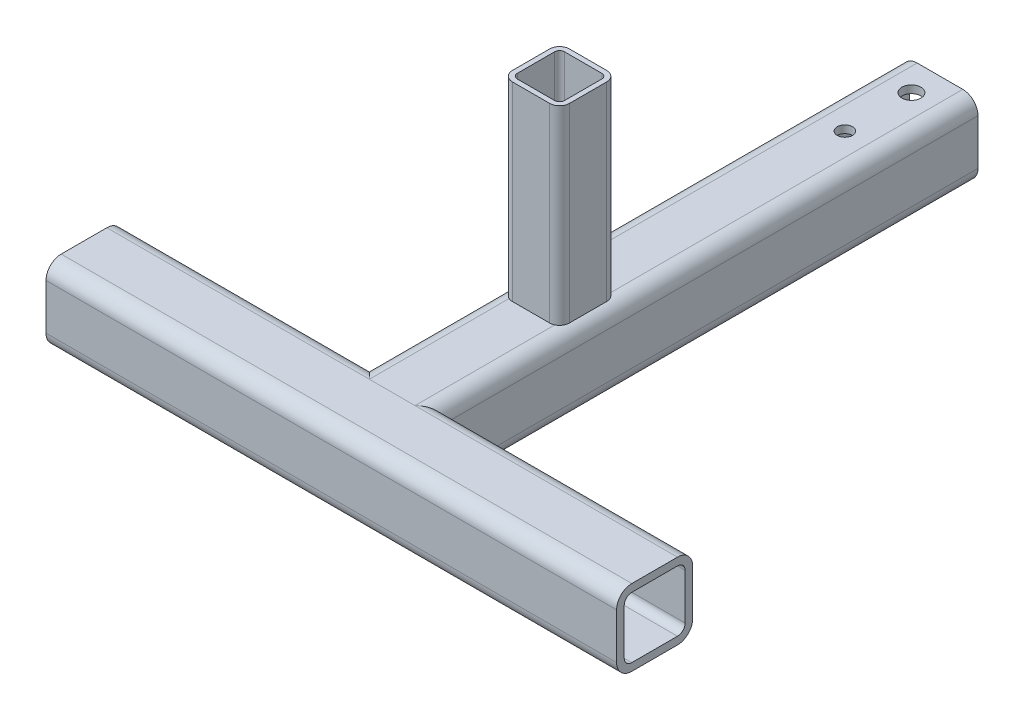
from build123d import *

# Parameters (mm, degrees)
SQUARE_TUBE_CONFIGURED_40_X_40_X_4_1_DEPTH   = 300
SQUARE_TUBE_CONFIGURED_40_X_40_X_4_2_DEPTH   = 300
SQUARE_TUBE_CONFIGURED_30_X_30_X_2_6_1_DEPTH = 100
CORTE_EXTRUS_O1_DEPTH                        = 351.000000086
CORTE_EXTRUS_O1_DEPTH_BACK                   = 351.000000086
ESBO_O8_R                                    = 5
ESBO_O8_R_2                                  = 4


with BuildPart() as part:
    # Sketch11 → Square tube - configured 40 X 40 X 4(1) (new body)
    with BuildSketch(Plane(origin=(-150, 0, 0), x_dir=(0, 0, -1), z_dir=(1, 0, 0))):
        with BuildLine():
            Line((-12, -20), (12, -20))
            ThreePointArc((12, -20), (17.656854249, -17.656854249), (20, -12))
            Line((20, -12), (20, 12))
            ThreePointArc((20, 12), (17.656854249, 17.656854249), (12, 20))
            Line((12, 20), (-12, 20))
            ThreePointArc((-12, 20), (-17.656854249, 17.656854249), (-20, 12))
            Line((-20, 12), (-20, -12))
            ThreePointArc((-20, -12), (-17.656854249, -17.656854249), (-12, -20))
        make_face()
        with BuildLine():
            Line((-12, -16), (12, -16))
            ThreePointArc((12, -16), (14.828427125, -14.828427125), (16, -12))
            Line((16, -12), (16, 12))
            ThreePointArc((16, 12), (14.828427125, 14.828427125), (12, 16))
            Line((12, 16), (-12, 16))
            ThreePointArc((-12, 16), (-14.828427125, 14.828427125), (-16, 12))
            Line((-16, 12), (-16, -12))
            ThreePointArc((-16, -12), (-14.828427125, -14.828427125), (-12, -16))
        make_face(mode=Mode.SUBTRACT)
    extrude(amount=SQUARE_TUBE_CONFIGURED_40_X_40_X_4_1_DEPTH)


with BuildPart() as body_2:
    # Sketch1 → Square tube - configured 40 X 40 X 4(2) (new body)
    with BuildSketch(Plane(origin=(0, 0, 0), x_dir=(-1, 0, 0), z_dir=(0, 0, -1))):
        with BuildLine():
            Line((-12, -20), (12, -20))
            ThreePointArc((12, -20), (17.656854249, -17.656854249), (20, -12))
            Line((20, -12), (20, 12))
            ThreePointArc((20, 12), (17.656854249, 17.656854249), (12, 20))
            Line((12, 20), (-12, 20))
            ThreePointArc((-12, 20), (-17.656854249, 17.656854249), (-20, 12))
            Line((-20, 12), (-20, -12))
            ThreePointArc((-20, -12), (-17.656854249, -17.656854249), (-12, -20))
        make_face()
        with BuildLine():
            Line((-12, -16), (12, -16))
            ThreePointArc((12, -16), (14.828427125, -14.828427125), (16, -12))
            Line((16, -12), (16, 12))
            ThreePointArc((16, 12), (14.828427125, 14.828427125), (12, 16))
            Line((12, 16), (-12, 16))
            ThreePointArc((-12, 16), (-14.828427125, 14.828427125), (-16, 12))
            Line((-16, 12), (-16, -12))
            ThreePointArc((-16, -12), (-14.828427125, -14.828427125), (-12, -16))
        make_face(mode=Mode.SUBTRACT)
    extrude(amount=SQUARE_TUBE_CONFIGURED_40_X_40_X_4_2_DEPTH)

    # Aparar_Estender1 45: cut part
    add(part.part, mode=Mode.SUBTRACT)


with BuildPart() as body_3:
    # of the pieces the cut leaves, the one that is kept (aparar_estender1_keep_1)
    add(body_2.part.solids().sort_by_distance((-12, -20, -12))[0])

    # Esboço8 → Corte-extrusão1 (cut, two sides: drawn at the far end of the back side and taken through both)
    with BuildSketch(Plane(origin=(0, 20, 0), x_dir=(1, 0, 0), z_dir=(0, 1, 0)).offset(-CORTE_EXTRUS_O1_DEPTH_BACK)):
        with Locations(Location((0, 285, 0), (0, 0, 90))):
            Circle(ESBO_O8_R)
        with Locations(Location((0, 250, 0), (0, 0, 90))):
            Circle(ESBO_O8_R_2)
    extrude(amount=CORTE_EXTRUS_O1_DEPTH + CORTE_EXTRUS_O1_DEPTH_BACK, mode=Mode.SUBTRACT)


with BuildPart() as body_3_2:
    # Sketch13 → Square tube - configured 30 X 30 X 2.6(1) (new body)
    with BuildSketch(Plane(origin=(0, 120, -100), x_dir=(0, 0, -1), z_dir=(0, -1, 0))):
        with BuildLine():
            Line((-9.8, -15), (9.8, -15))
            ThreePointArc((9.8, -15), (13.476955262, -13.476955262), (15, -9.8))
            Line((15, -9.8), (15, 9.8))
            ThreePointArc((15, 9.8), (13.476955262, 13.476955262), (9.8, 15))
            Line((9.8, 15), (-9.8, 15))
            ThreePointArc((-9.8, 15), (-13.476955262, 13.476955262), (-15, 9.8))
            Line((-15, 9.8), (-15, -9.8))
            ThreePointArc((-15, -9.8), (-13.476955262, -13.476955262), (-9.8, -15))
        make_face()
        with BuildLine():
            Line((-9.8, -12.4), (9.8, -12.4))
            ThreePointArc((9.8, -12.4), (11.638477631, -11.638477631), (12.4, -9.8))
            Line((12.4, -9.8), (12.4, 9.8))
            ThreePointArc((12.4, 9.8), (11.638477631, 11.638477631), (9.8, 12.4))
            Line((9.8, 12.4), (-9.8, 12.4))
            ThreePointArc((-9.8, 12.4), (-11.638477631, 11.638477631), (-12.4, 9.8))
            Line((-12.4, 9.8), (-12.4, -9.8))
            ThreePointArc((-12.4, -9.8), (-11.638477631, -11.638477631), (-9.8, -12.4))
        make_face(mode=Mode.SUBTRACT)
    extrude(amount=SQUARE_TUBE_CONFIGURED_30_X_30_X_2_6_1_DEPTH)


solid = Compound([part.part, body_3.part, body_3_2.part])
